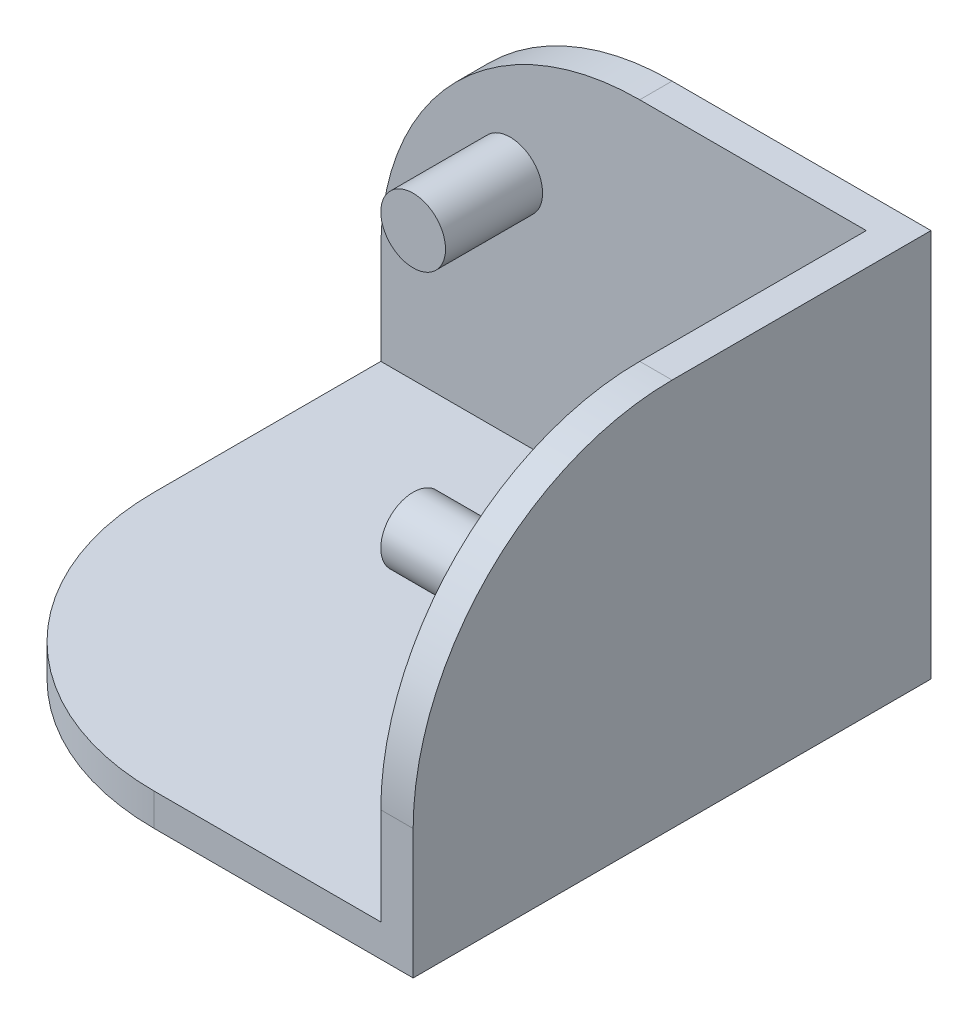
from build123d import *

# Parameters (mm, degrees)
SKETCH1_W           = 80
SKETCH1_H           = 80
BOSS_EXTRUDE1_DEPTH = 5
EXTRUDE_THIN1_DEPTH = 55
FILLET1_R           = 40
SKETCH4_R           = 5
BOSS_EXTRUDE2_DEPTH = 15
SKETCH5_R           = 5
BOSS_EXTRUDE3_DEPTH = 15


with BuildPart() as part:
    # Sketch1 → Boss-Extrude1 (new body)
    with BuildSketch(Plane(origin=(0, 0, 0), x_dir=(1, 0, 0), z_dir=(0, 1, 0))):
        Rectangle(SKETCH1_W, SKETCH1_H)
    extrude(amount=BOSS_EXTRUDE1_DEPTH)

    # Sketch3 → Extrude-Thin1 (add)
    with BuildSketch(Plane(origin=(0, 5, 0), x_dir=(1, 0, 0), z_dir=(0, 1, 0))):
        Polygon((-40, 40), (40, 40), (40, -40), (35, -40), (35, 35), (-40, 35), align=None)
    extrude(amount=EXTRUDE_THIN1_DEPTH)

    # Fillet1
    fillet1_edges = [part.edges().sort_by_distance(p)[0] for p in [
        (37.5, 60, 40),
        (-40, 60, -37.5),
        (-40, 2.5, 40),
    ]]
    fillet(fillet1_edges, radius=FILLET1_R)

    # Sketch4 → Boss-Extrude2 (add)
    with BuildSketch(Plane.ZY.offset(-35)):
        with Locations(Location((20, 40, 0), (0, 0, 180))):
            Circle(SKETCH4_R)
    extrude(amount=BOSS_EXTRUDE2_DEPTH)

    # Sketch5 → Boss-Extrude3 (add)
    with BuildSketch(Plane.XY.offset(-35)):
        with Locations(Location((-20, 40, 0), (0, 0, 180))):
            Circle(SKETCH5_R)
    extrude(amount=BOSS_EXTRUDE3_DEPTH)


solid = part.part
